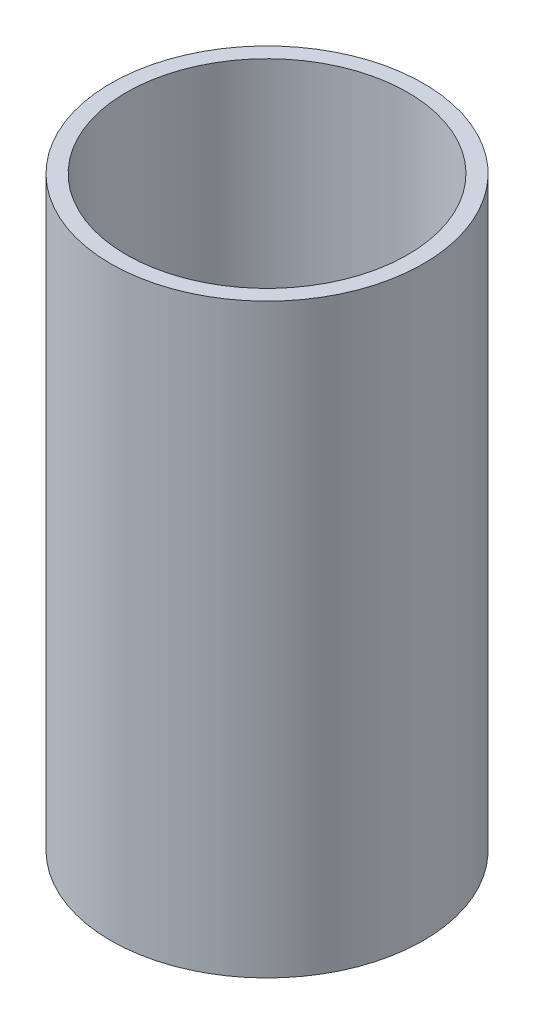
from build123d import *

# Parameters (mm, degrees)
SKETCH1_R           = 40
SKETCH1_R_2         = 36
BOSS_EXTRUDE1_DEPTH = 150


with BuildPart() as part:
    # Sketch1 → Boss-Extrude1 (new body)
    with BuildSketch(Plane(origin=(0, 0, 0), x_dir=(1, 0, 0), z_dir=(0, 1, 0))):
        with Locations(Location((0, 0, 0), (0, 0, 270))):
            Circle(SKETCH1_R)
        with Locations(Location((0, 0, 0), (0, 0, 270))):
            Circle(SKETCH1_R_2, mode=Mode.SUBTRACT)
    extrude(amount=BOSS_EXTRUDE1_DEPTH)


solid = part.part
